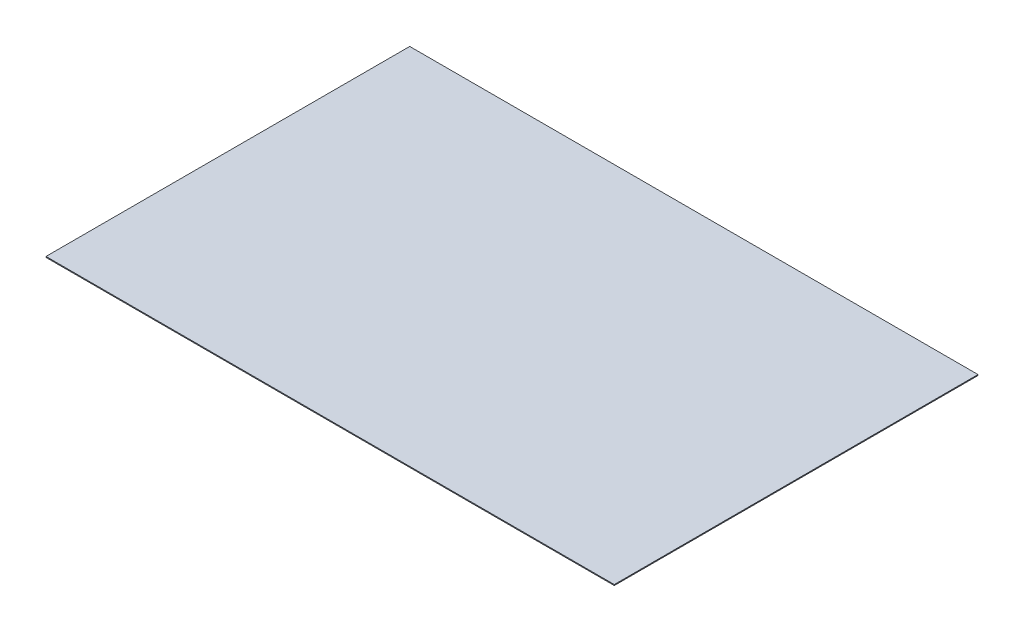
from build123d import *

# Parameters (mm, degrees)
MASTER_FOOTPRINT_W    = 1250
MASTER_FOOTPRINT_H    = 800
BATH_BASE_PLATE_DEPTH = 2


with BuildPart() as part:
    # MASTER_FOOTPRINT → BATH_BASE_PLATE (new body)
    with BuildSketch(Plane(origin=(0, 0, 0), x_dir=(1, 0, 0), z_dir=(0, 1, 0))):
        with Locations((625, 400)):
            Rectangle(MASTER_FOOTPRINT_W, MASTER_FOOTPRINT_H)
    extrude(amount=BATH_BASE_PLATE_DEPTH)


solid = part.part
